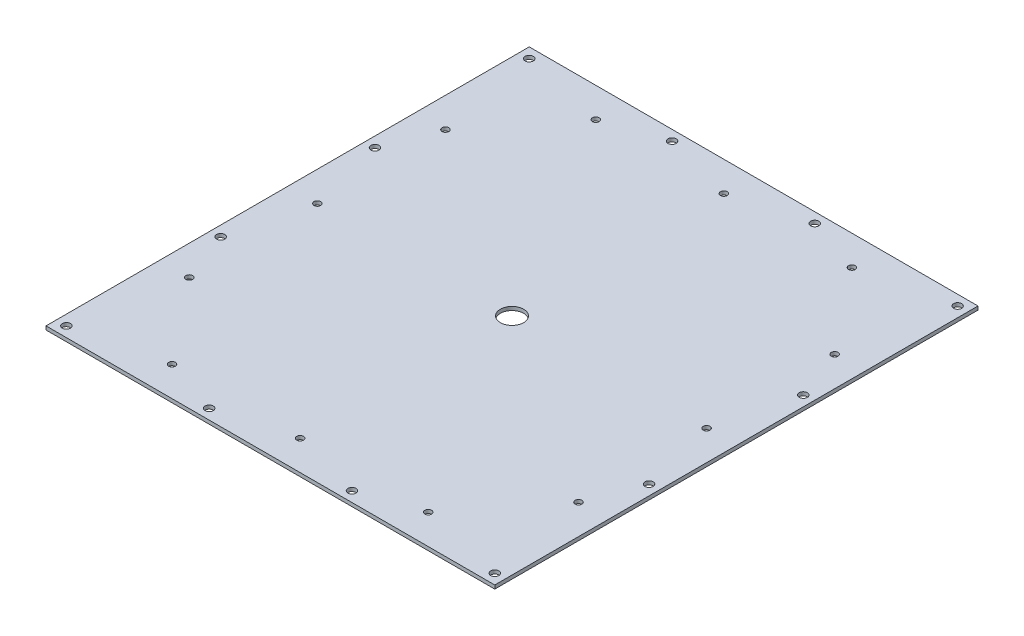
from build123d import *

# Parameters (mm, degrees)
SKETCH2_W           = 195.7832
SKETCH2_H           = 210.82
SKETCH2_R           = 1.778
SKETCH2_R_2         = 1.4732
SKETCH2_R_3         = 5.08
BOSS_EXTRUDE1_DEPTH = 1.5748


with BuildPart() as part:
    # Sketch2 → Boss-Extrude1 (new body)
    with BuildSketch(Plane(origin=(0, 0, 0), x_dir=(1, 0, 0), z_dir=(0, 1, 0))):
        with Locations((89.0016, 96.52)):
            Rectangle(SKETCH2_W, SKETCH2_H)
        with Locations(Location((-4.445, -4.445, 0), (0, 0, 270))):
            Circle(SKETCH2_R, mode=Mode.SUBTRACT)
        with Locations(Location((-4.445, 197.485, 0), (0, 0, 270))):
            Circle(SKETCH2_R, mode=Mode.SUBTRACT)
        with Locations(Location((-4.445, 62.865, 0), (0, 0, 270))):
            Circle(SKETCH2_R, mode=Mode.SUBTRACT)
        with Locations(Location((-4.445, 130.175, 0), (0, 0, 270))):
            Circle(SKETCH2_R, mode=Mode.SUBTRACT)
        with Locations(Location((57.8612, 197.485, 0), (0, 0, 270))):
            Circle(SKETCH2_R, mode=Mode.SUBTRACT)
        with Locations(Location((120.142, 197.485, 0), (0, 0, 270))):
            Circle(SKETCH2_R, mode=Mode.SUBTRACT)
        with Locations(Location((57.8612, -4.445, 0), (0, 0, 270))):
            Circle(SKETCH2_R, mode=Mode.SUBTRACT)
        with Locations(Location((120.142, -4.445, 0), (0, 0, 270))):
            Circle(SKETCH2_R, mode=Mode.SUBTRACT)
        with Locations(Location((182.4482, -4.445, 0), (0, 0, 270))):
            Circle(SKETCH2_R, mode=Mode.SUBTRACT)
        with Locations(Location((182.4482, 197.485, 0), (0, 0, 270))):
            Circle(SKETCH2_R, mode=Mode.SUBTRACT)
        with Locations(Location((182.4482, 62.865, 0), (0, 0, 270))):
            Circle(SKETCH2_R, mode=Mode.SUBTRACT)
        with Locations(Location((182.4482, 130.175, 0), (0, 0, 270))):
            Circle(SKETCH2_R, mode=Mode.SUBTRACT)
        with Locations(Location((33.1216, 4.0894, 0), (0, 0, 270))):
            Circle(SKETCH2_R_2, mode=Mode.SUBTRACT)
        with Locations(Location((89.0016, 4.0894, 0), (0, 0, 270))):
            Circle(SKETCH2_R_2, mode=Mode.SUBTRACT)
        with Locations(Location((144.8816, 4.0894, 0), (0, 0, 270))):
            Circle(SKETCH2_R_2, mode=Mode.SUBTRACT)
        with Locations(Location((33.1216, 188.9506, 0), (0, 0, 270))):
            Circle(SKETCH2_R_2, mode=Mode.SUBTRACT)
        with Locations(Location((89.0016, 188.9506, 0), (0, 0, 270))):
            Circle(SKETCH2_R_2, mode=Mode.SUBTRACT)
        with Locations(Location((144.8816, 188.9506, 0), (0, 0, 270))):
            Circle(SKETCH2_R_2, mode=Mode.SUBTRACT)
        with Locations(Location((4.0894, 40.64, 0), (0, 0, 270))):
            Circle(SKETCH2_R_2, mode=Mode.SUBTRACT)
        with Locations(Location((4.0894, 96.52, 0), (0, 0, 270))):
            Circle(SKETCH2_R_2, mode=Mode.SUBTRACT)
        with Locations(Location((4.0894, 152.4, 0), (0, 0, 270))):
            Circle(SKETCH2_R_2, mode=Mode.SUBTRACT)
        with Locations(Location((173.8884, 40.64, 0), (0, 0, 270))):
            Circle(SKETCH2_R_2, mode=Mode.SUBTRACT)
        with Locations(Location((173.8884, 96.52, 0), (0, 0, 270))):
            Circle(SKETCH2_R_2, mode=Mode.SUBTRACT)
        with Locations(Location((173.8884, 152.4, 0), (0, 0, 270))):
            Circle(SKETCH2_R_2, mode=Mode.SUBTRACT)
        with Locations(Location((89.0016, 96.52, 0), (0, 0, 270))):
            Circle(SKETCH2_R_3, mode=Mode.SUBTRACT)
    extrude(amount=BOSS_EXTRUDE1_DEPTH)


solid = part.part
